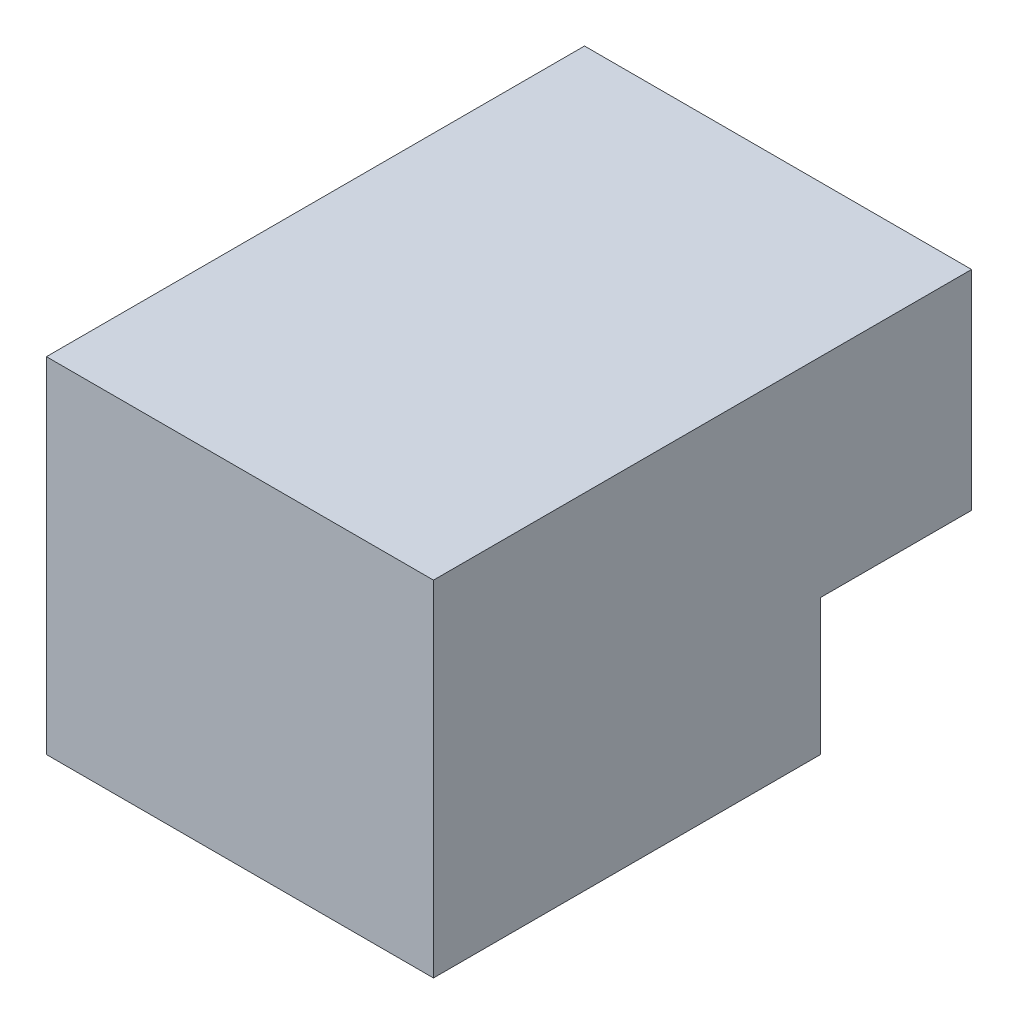
from build123d import *

# Parameters (mm, degrees)
SKETCH1_W                = 65.08
SKETCH1_H                = 65.08
SKETCH1_W_2              = 60
SKETCH1_H_2              = 60
BOSS_EXTRUDE1_DEPTH      = 25.4
BOSS_EXTRUDE2_DEPTH      = 25.4
BOSS_EXTRUDE2_DEPTH_BACK = 65.08
SKETCH4_W                = 65.08
SKETCH4_H                = 2.54
BOSS_EXTRUDE3_DEPTH      = 25.4
SKETCH5_W                = 60
SKETCH5_H                = 30
BOSS_EXTRUDE4_DEPTH      = 2.54


with BuildPart() as part:
    # Sketch1 → Boss-Extrude1 (new body)
    with BuildSketch(Plane(origin=(0, 0, 0), x_dir=(1, 0, 0), z_dir=(0, 1, 0))):
        with Locations((30, 30)):
            Rectangle(SKETCH1_W, SKETCH1_H)
        with Locations((30, 30)):
            Rectangle(SKETCH1_W_2, SKETCH1_H_2, mode=Mode.SUBTRACT)
    extrude(amount=BOSS_EXTRUDE1_DEPTH)

    # Sketch2 → Boss-Extrude2 (add, two sides: drawn at the far end of the back side and taken through both)
    with BuildSketch(Plane(origin=(0, 0, -62.54), x_dir=(-1, 0, 0), z_dir=(0, 0, -1)).offset(-BOSS_EXTRUDE2_DEPTH_BACK)):
        Polygon((0, 25.4), (0, 55.4), (-60, 55.4), (-60, 25.4), (-62.54, 25.4), (-62.54, 57.94), (2.54, 57.94), (2.54, 25.4), align=None)
    extrude(amount=BOSS_EXTRUDE2_DEPTH + BOSS_EXTRUDE2_DEPTH_BACK)

    # Sketch4 → Boss-Extrude3 (add)
    with BuildSketch(Plane(origin=(0, 0, -62.54), x_dir=(-1, 0, 0), z_dir=(0, 0, -1))):
        with Locations((-30, 24.13)):
            Rectangle(SKETCH4_W, SKETCH4_H)
    extrude(amount=BOSS_EXTRUDE3_DEPTH)

    # Sketch5 → Boss-Extrude4 (add)
    with BuildSketch(Plane.XY.offset(2.54)):
        with Locations((30, 40.4)):
            Rectangle(SKETCH5_W, SKETCH5_H)
    extrude(amount=-BOSS_EXTRUDE4_DEPTH)


solid = part.part
